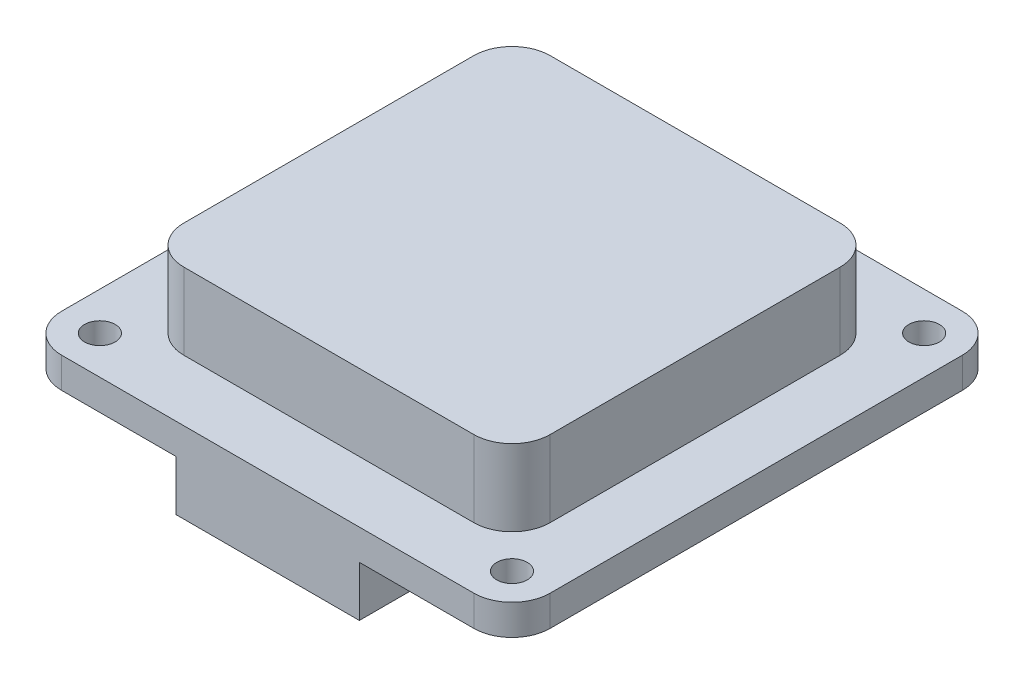
from build123d import *

# Parameters (mm, degrees)
BOSS_EXTRUDE1_DEPTH     = 10.3
SKETCH2_OUTSIDE_W       = 43.282
SKETCH2_OUTSIDE_H       = 43.282
CUT_EXTRUDE1_DEPTH      = 5
CUT_EXTRUDE2_DEPTH      = 24.239836488
CUT_EXTRUDE2_DEPTH_BACK = 24.239836488
SKETCH4_R               = 1
CUT_EXTRUDE3_DEPTH      = 38.230229653
CUT_EXTRUDE3_DEPTH_BACK = 38.230229653
SKETCH6_W               = 12
SKETCH6_H               = 22
CUT_EXTRUDE4_DEPTH      = 3.3


with BuildPart() as part:
    # Sketch1 → Boss-Extrude1 (new body)
    with BuildSketch(Plane(origin=(0, 0, 0), x_dir=(1, 0, 0), z_dir=(0, 1, 0))):
        with BuildLine():
            Line((-13.5, 16), (13.5, 16))
            ThreePointArc((13.5, 16), (15.267766953, 15.267766953), (16, 13.5))
            Line((16, 13.5), (16, -13.5))
            ThreePointArc((16, -13.5), (15.267766953, -15.267766953), (13.5, -16))
            Line((13.5, -16), (-13.5, -16))
            ThreePointArc((-13.5, -16), (-15.267766953, -15.267766953), (-16, -13.5))
            Line((-16, -13.5), (-16, 13.5))
            ThreePointArc((-16, 13.5), (-15.267766953, 15.267766953), (-13.5, 16))
        make_face()
    extrude(amount=BOSS_EXTRUDE1_DEPTH)

    # Sketch2 outside → Cut-Extrude1 (cut)
    with BuildSketch(Plane(origin=(0, 10.3, 0), x_dir=(1, 0, 0), z_dir=(0, 1, 0))):
        Rectangle(SKETCH2_OUTSIDE_W, SKETCH2_OUTSIDE_H)
        with BuildLine():
            Line((-9.5, -12), (9.5, -12))
            ThreePointArc((9.5, -12), (11.267766953, -11.267766953), (12, -9.5))
            Line((12, -9.5), (12, 9.5))
            ThreePointArc((12, 9.5), (11.267766953, 11.267766953), (9.5, 12))
            Line((9.5, 12), (-9.5, 12))
            ThreePointArc((-9.5, 12), (-11.267766953, 11.267766953), (-12, 9.5))
            Line((-12, 9.5), (-12, -9.5))
            ThreePointArc((-12, -9.5), (-11.267766953, -11.267766953), (-9.5, -12))
        make_face(mode=Mode.SUBTRACT)
    extrude(amount=-CUT_EXTRUDE1_DEPTH, mode=Mode.SUBTRACT)

    # Sketch4 → Cut-Extrude2 (cut, two sides: drawn at the far end of the back side and taken through both)
    with BuildSketch(Plane(origin=(0, 5.3, 0), x_dir=(1, 0, 0), z_dir=(0, 1, 0)).offset(-CUT_EXTRUDE2_DEPTH_BACK)):
        with Locations(Location((-13.5, 13.5, 0), (0, 0, 270))):
            Circle(SKETCH4_R)
        with Locations(Location((13.5, -13.5, 0), (0, 0, 270))):
            Circle(SKETCH4_R)
        with Locations(Location((-13.5, -13.5, 0), (0, 0, 270))):
            Circle(SKETCH4_R)
        with Locations(Location((13.5, 13.5, 0), (0, 0, 270))):
            Circle(SKETCH4_R)
    extrude(amount=CUT_EXTRUDE2_DEPTH + CUT_EXTRUDE2_DEPTH_BACK, mode=Mode.SUBTRACT)

    # Sketch5 → Cut-Extrude3 (cut, two sides: drawn at the far end of the back side and taken through both)
    with BuildSketch(Plane.XY.offset(16).offset(-CUT_EXTRUDE3_DEPTH_BACK)):
        Polygon((-17.244345891, 3.3), (-17.244345891, -0.614628683), (-6, -0.614628683), (-6, 0), (-6, 0.3), (-6, 3.3), align=None)
        Polygon((6, 3.3), (6, 0.3), (6, 0), (6, -0.614628683), (18.655939846, -0.614628683), (18.655939846, 3.3), align=None)
    extrude(amount=CUT_EXTRUDE3_DEPTH + CUT_EXTRUDE3_DEPTH_BACK, mode=Mode.SUBTRACT)

    # Sketch6 → Cut-Extrude4 (cut)
    with BuildSketch(Plane.XZ):
        Rectangle(SKETCH6_W, SKETCH6_H)
    extrude(amount=-CUT_EXTRUDE4_DEPTH, mode=Mode.SUBTRACT)


solid = part.part
